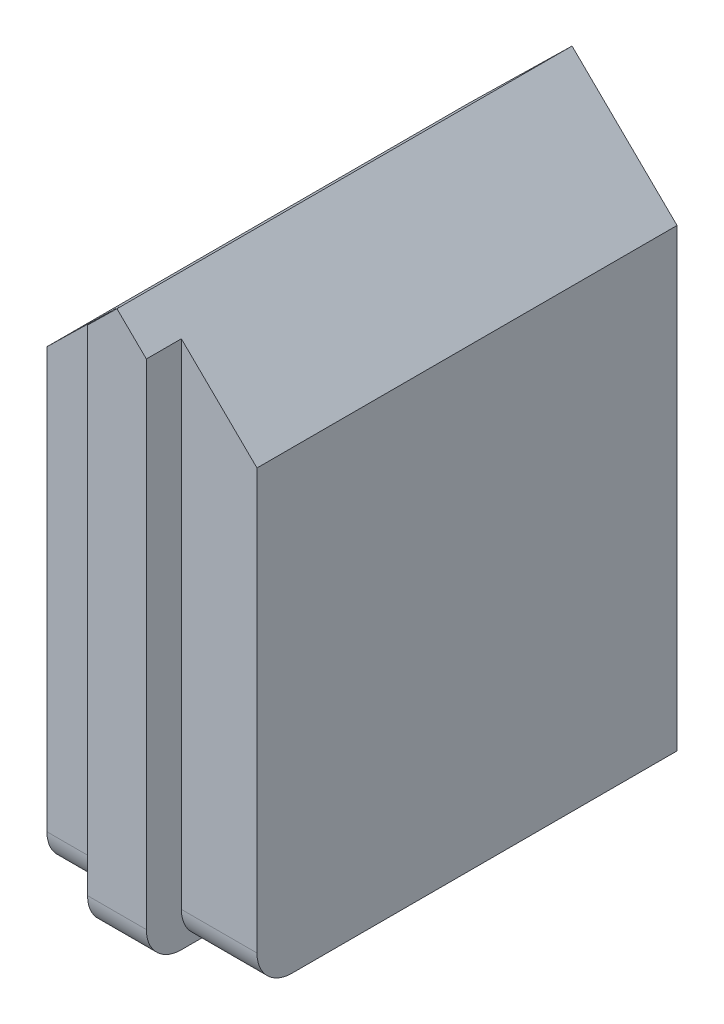
from build123d import *

# Parameters (mm, degrees)
EXTRUSION1_DEPTH = 12
EXTRUSION2_DEPTH = 1
CONG_3_R         = 1
CONG_4_R         = 1
CONG_5_R         = 1


with BuildPart() as part:
    # Esquisse1 → Extrusion1 (new body)
    with BuildSketch(Plane.XY):
        Polygon((0, 0), (0, 13), (3, 15.939387691), (6, 13), (6, 0), align=None)
    extrude(amount=EXTRUSION1_DEPTH)

    # Esquisse3 → Extrusion2 (add)
    with BuildSketch(Plane.XY.offset(12)):
        Polygon((2.160028245, 15.116386813), (2.160028245, 0), (3.839971755, 0), (3.839971755, 15.116386813), (3, 15.939387691), align=None)
    extrude(amount=EXTRUSION2_DEPTH)

    # Congé3
    cong_3_edges = [part.edges().sort_by_distance(p)[0] for p in [
        (1.080014123, 0, 12),
    ]]
    fillet(cong_3_edges, radius=CONG_3_R)

    # Congé4
    cong_4_edges = [part.edges().sort_by_distance(p)[0] for p in [
        (4.919985877, 0, 12),
    ]]
    fillet(cong_4_edges, radius=CONG_4_R)

    # Congé5
    cong_5_edges = [part.edges().sort_by_distance(p)[0] for p in [
        (3, 0, 13),
    ]]
    fillet(cong_5_edges, radius=CONG_5_R)


solid = part.part
